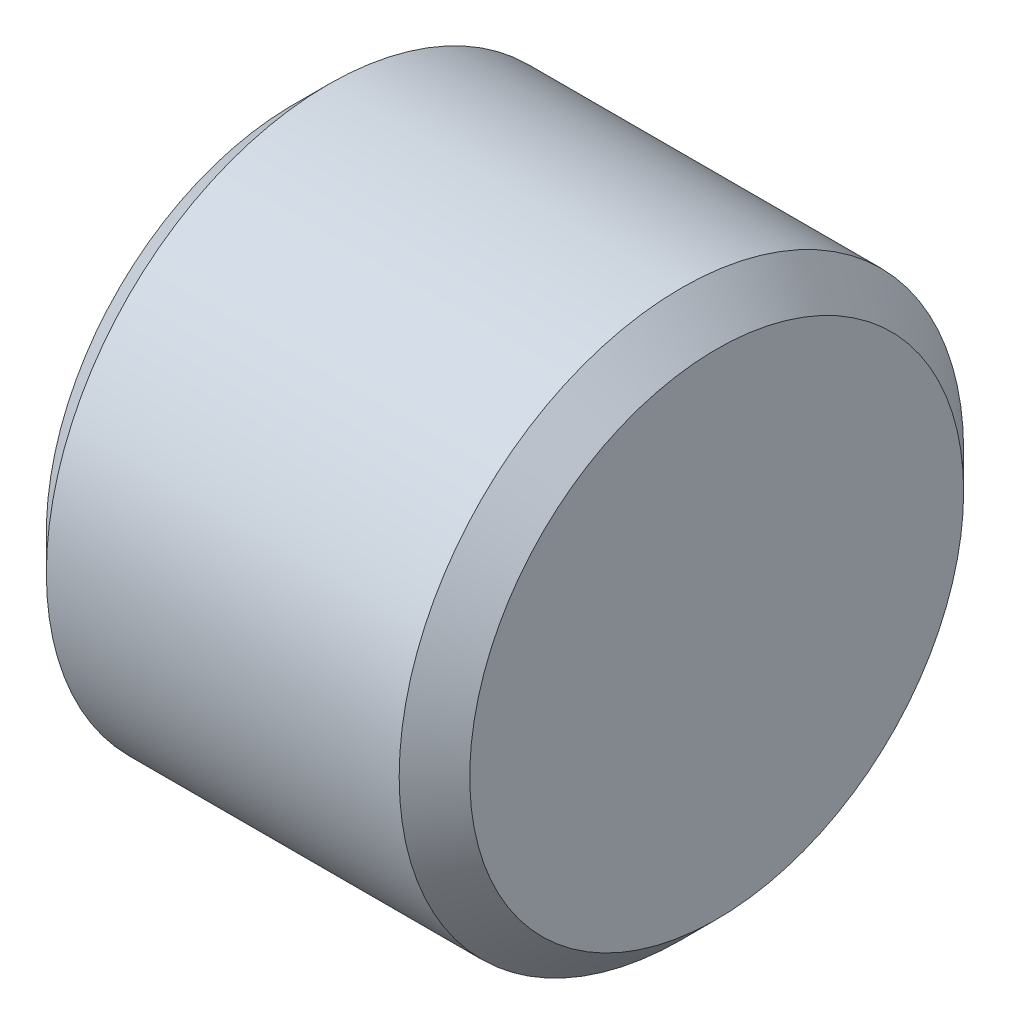
from build123d import *

# Parameters (mm, degrees)
SKETCH1_R           = 4
BOSS_EXTRUDE1_DEPTH = 6
CHAMFER1_SIZE       = 0.5


with BuildPart() as part:
    # Sketch1 → Boss-Extrude1 (new body)
    with BuildSketch(Plane(origin=(0, 0, 0), x_dir=(0, 0, -1), z_dir=(1, 0, 0))):
        Circle(SKETCH1_R)
    extrude(amount=BOSS_EXTRUDE1_DEPTH)

    # Chamfer1
    chamfer1_edges = [part.edges().sort_by_distance(p)[0] for p in [
        (0, 0, 4),
        (6, 0, 4),
    ]]
    chamfer(chamfer1_edges, length=CHAMFER1_SIZE)


solid = part.part
